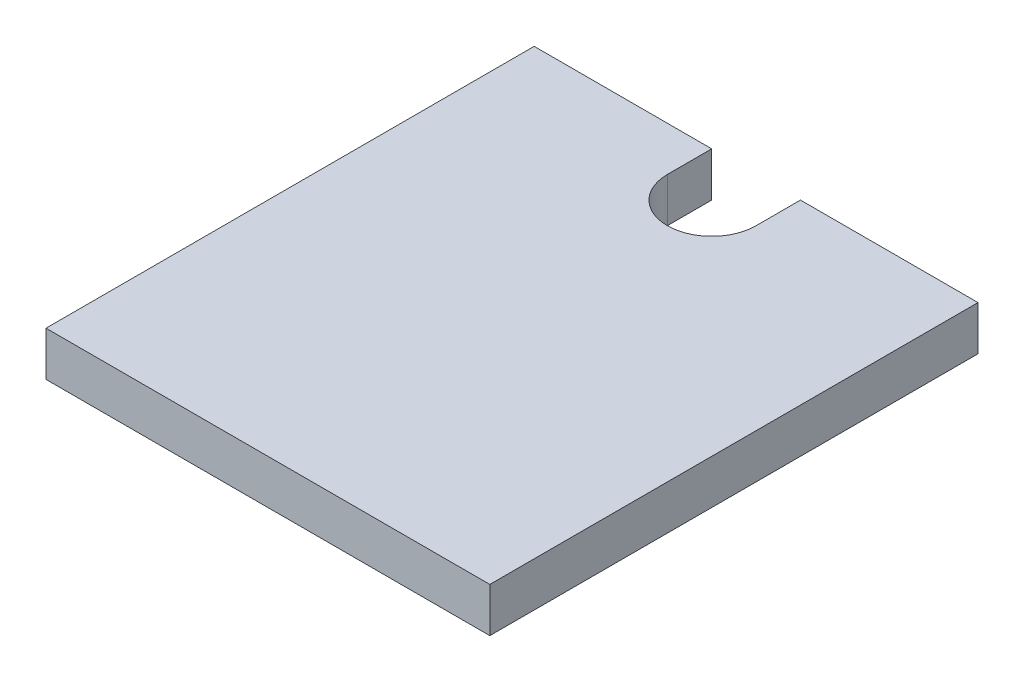
from build123d import *

# Parameters (mm, degrees)
BOSS_EXTRUDE5_DEPTH = 5


with BuildPart() as part:
    # Sketch2 → Boss-Extrude5 (new body)
    with BuildSketch(Plane(origin=(0, 0, 0), x_dir=(1, 0, 0), z_dir=(0, 1, 0))):
        with BuildLine():
            Line((-25, 27.5), (-5, 27.5))
            Line((-5, 27.5), (-5, 22.5))
            ThreePointArc((-5, 22.5), (0, 17.5), (5, 22.5))
            Line((5, 22.5), (5, 27.5))
            Line((5, 27.5), (25, 27.5))
            Line((25, 27.5), (25, -27.5))
            Line((25, -27.5), (-25, -27.5))
            Line((-25, -27.5), (-25, 27.5))
        make_face()
    extrude(amount=BOSS_EXTRUDE5_DEPTH)


solid = part.part
